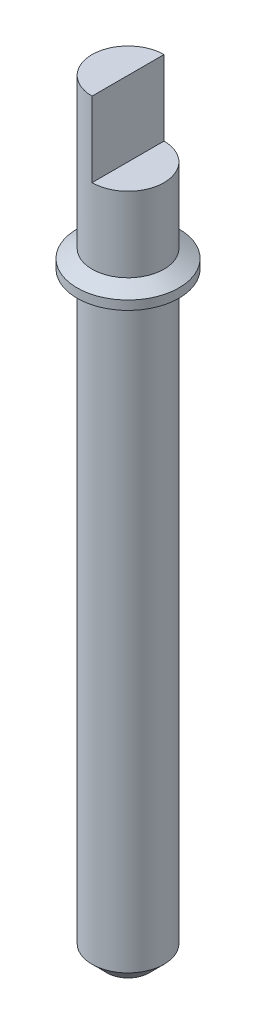
from build123d import *

# Parameters (mm, degrees)
CUT_EXTRUDE1_START = -1.25
CUT_EXTRUDE1_DEPTH = 1.25
CHAMFER1_SIZE      = 0.25


with BuildPart() as part:
    # Sketch1 → Revolve1 (revolve)
    with BuildSketch(Plane.XY):
        Polygon((0, 0), (0, 2.719337567), (0.6, 2.719337567), (0.6, 0.219337567), (0.85, 0.075), (0.85, -0.075), (0.6, -0.219337567), (0.6, -10.069337567), (0, -10.069337567), align=None)
    revolve(axis=Axis((0, 0, 0), (0, 1, 0)))

    # Sketch2 → Cut-Extrude1 (cut)
    with BuildSketch(Plane(origin=(0, 2.719337567, 0), x_dir=(1, 0, 0), z_dir=(0, 1, 0)).offset(CUT_EXTRUDE1_START)):
        with BuildLine():
            Line((0, 0.6), (0, -0.6))
            ThreePointArc((0, -0.6), (0.6, 0), (0, 0.6))
        make_face()
    extrude(amount=CUT_EXTRUDE1_DEPTH, mode=Mode.SUBTRACT)

    # Chamfer1
    chamfer1_edges = [part.edges().sort_by_distance(p)[0] for p in [
        (-0.6, -10.069337567, 0),
    ]]
    chamfer(chamfer1_edges, length=CHAMFER1_SIZE)


solid = part.part
